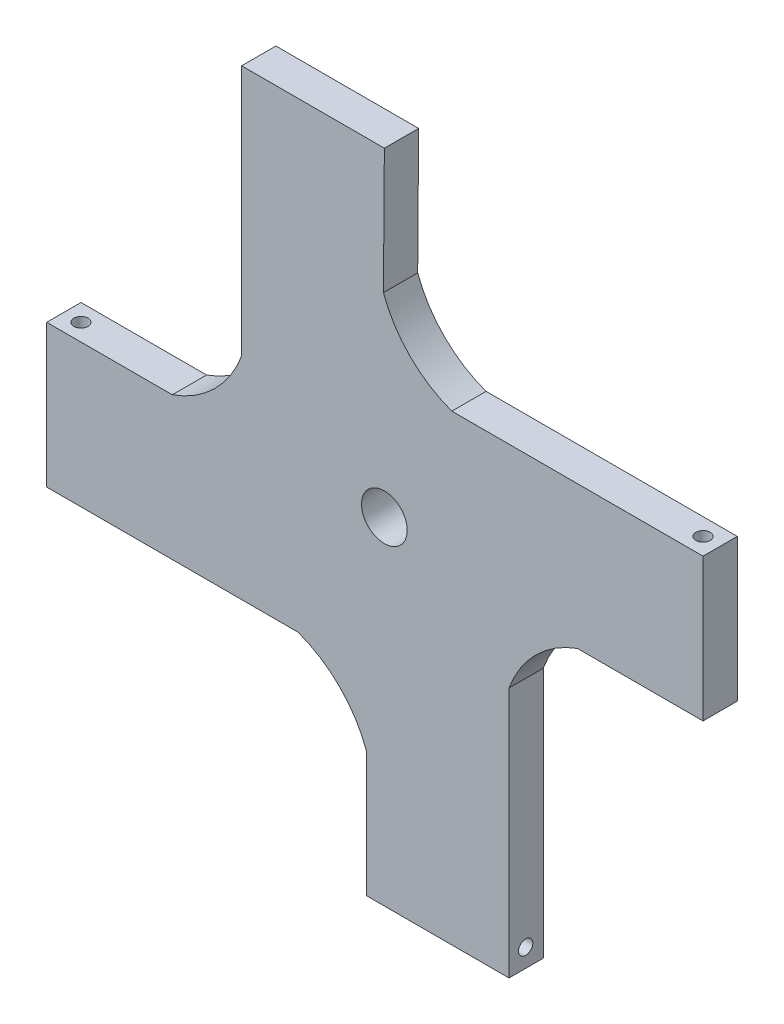
from build123d import *

# Parameters (mm, degrees)
SKETCH_2_R          = 4
EXTRUDE_1_DEPTH     = 6
SKETCH_3_R          = 1.25
CUT_EXTRUDE_1_DEPTH = 5
CUT_EXTRUDE_START   = -5
SKETCH_4_R          = 1.25
CUT_EXTRUDE_2_DEPTH = 5
SKETCH_5_R          = 1.25
CUT_EXTRUDE_3_DEPTH = 5
SKETCH_6_R          = 1.25
CUT_EXTRUDE_4_DEPTH = 5
SKETCH_8_R          = 1.25
CUT_EXTRUDE_5_DEPTH = 5
SKETCH_9_R          = 1.25
CUT_EXTRUDE_6_DEPTH = 5


with BuildPart() as part:
    # 스케치2 → 보스-돌출1 (new body)
    with BuildSketch(Plane.XY):
        with BuildLine():
            Line((-102.525284978, -57.601148056), (-102.525284978, -32.601148056))
            Line((-102.525284978, -32.601148056), (-80.525284978, -32.601148056))
            ThreePointArc((-80.525284978, -32.601148056), (-73.11411316, -27.970582536), (-68.384824454, -20.622015799))
            Line((-68.384824454, -20.622015799), (-68.384824454, 23.377984201))
            Line((-68.384824454, 23.377984201), (-43.384824454, 23.377984201))
            Line((-43.384824454, 23.377984201), (-43.545565494, 1.378571429))
            ThreePointArc((-43.545565494, 1.378571429), (-38.886846868, -5.94242943), (-31.565846009, -10.601148056))
            Line((-31.565846009, -10.601148056), (12.434153991, -10.601148056))
            Line((12.434153991, -10.601148056), (12.434153991, -35.601148056))
            Line((12.434153991, -35.601148056), (-9.565846009, -35.601148056))
            ThreePointArc((-9.565846009, -35.601148056), (-16.886846868, -40.259866682), (-21.545565494, -47.580867541))
            Line((-21.545565494, -47.580867541), (-21.545565494, -91.580867541))
            Line((-21.545565494, -91.580867541), (-46.545565494, -91.580867541))
            Line((-46.545565494, -91.580867541), (-46.545565494, -69.580867541))
            ThreePointArc((-46.545565494, -69.580867541), (-51.20428412, -62.259866682), (-58.525284978, -57.601148056))
            Line((-58.525284978, -57.601148056), (-102.525284978, -57.601148056))
        make_face()
        with Locations((-43.384824454, -32.601148056)):
            Circle(SKETCH_2_R, mode=Mode.SUBTRACT)
    extrude(amount=EXTRUDE_1_DEPTH)

    # 스케치3 → 컷-돌출1 (cut)
    with BuildSketch(Plane(origin=(0, -57.601148056, 0), x_dir=(-1, 0, 0), z_dir=(0, -1, 0))):
        with Locations(Location((99.525284978, -3, 0), (0, 0, 90))):
            Circle(SKETCH_3_R)
    extrude(amount=-CUT_EXTRUDE_1_DEPTH, mode=Mode.SUBTRACT)

    # 스케치4 → 컷-돌출2 (cut)
    with BuildSketch(Plane(origin=(0, -32.601148056, 0), x_dir=(1, 0, 0), z_dir=(0, 1, 0)).offset(CUT_EXTRUDE_START)):
        with Locations(Location((-99.525284978, -3, 0), (0, 0, 90))):
            Circle(SKETCH_4_R)
    extrude(amount=CUT_EXTRUDE_2_DEPTH, mode=Mode.SUBTRACT)

    # 스케치5 → 컷-돌출3 (cut)
    with BuildSketch(Plane(origin=(-21.545565494, 0, 0), x_dir=(0, 0, -1), z_dir=(1, 0, 0))):
        with Locations(Location((-3.087647422, -88.347802665, 0), (0, 0, 90))):
            Circle(SKETCH_5_R)
    extrude(amount=-CUT_EXTRUDE_3_DEPTH, mode=Mode.SUBTRACT)

    # 스케치6 → 컷-돌출4 (cut)
    with BuildSketch(Plane.ZY.offset(46.545565494).offset(CUT_EXTRUDE_START)):
        with Locations(Location((3.087647422, -88.347802665, 0), (0, 0, 90))):
            Circle(SKETCH_6_R)
    extrude(amount=CUT_EXTRUDE_4_DEPTH, mode=Mode.SUBTRACT)

    # 스케치8 → 컷-돌출5 (cut)
    with BuildSketch(Plane(origin=(0, -10.601148056, 0), x_dir=(1, 0, 0), z_dir=(0, 1, 0))):
        with Locations(Location((9.434153991, -3, 0), (0, 0, 180))):
            Circle(SKETCH_8_R)
    extrude(amount=-CUT_EXTRUDE_5_DEPTH, mode=Mode.SUBTRACT)

    # 스케치9 → 컷-돌출6 (cut)
    with BuildSketch(Plane(origin=(0, -35.601148056, 0), x_dir=(-1, 0, 0), z_dir=(0, -1, 0)).offset(CUT_EXTRUDE_START)):
        with Locations((-9.434153991, -3)):
            Circle(SKETCH_9_R)
    extrude(amount=CUT_EXTRUDE_6_DEPTH, mode=Mode.SUBTRACT)


solid = part.part
